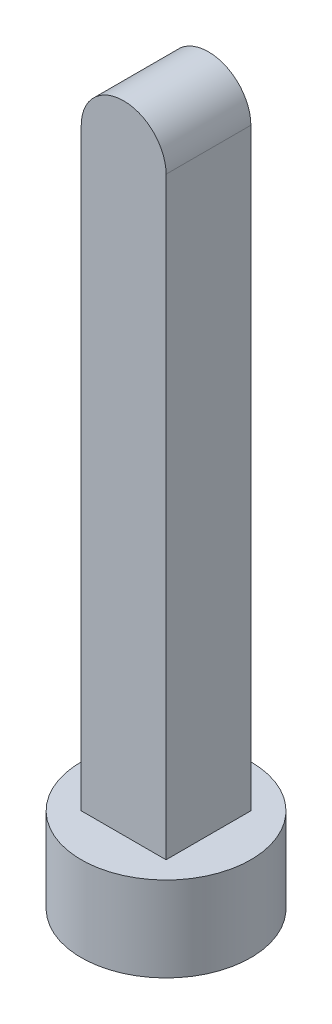
from build123d import *

# Parameters (mm, degrees)
ESQUISSE1_W        = 25
ESQUISSE1_H        = 25
BOSS_EXTRU_1_DEPTH = 200
BOSS_EXTRU_2_DEPTH = 25
ESQUISSE3_R        = 25
BOSS_EXTRU_3_DEPTH = 25


with BuildPart() as part:
    # Esquisse1 → Boss.-Extru.1 (new body)
    with BuildSketch(Plane(origin=(0, 0, 0), x_dir=(1, 0, 0), z_dir=(0, 1, 0))):
        Rectangle(ESQUISSE1_W, ESQUISSE1_H)
    extrude(amount=BOSS_EXTRU_1_DEPTH)

    # Esquisse2 → Boss.-Extru.2 (add)
    with BuildSketch(Plane.XY.offset(12.5)):
        with BuildLine():
            Line((-12.5, 200), (12.5, 200))
            ThreePointArc((12.5, 200), (0, 212.5), (-12.5, 200))
        make_face()
    extrude(amount=-BOSS_EXTRU_2_DEPTH)

    # Esquisse3 → Boss.-Extru.3 (add)
    with BuildSketch(Plane.XZ):
        with Locations(Location((0, 0, 0), (0, 0, 270))):
            Circle(ESQUISSE3_R)
    extrude(amount=-BOSS_EXTRU_3_DEPTH)


solid = part.part
